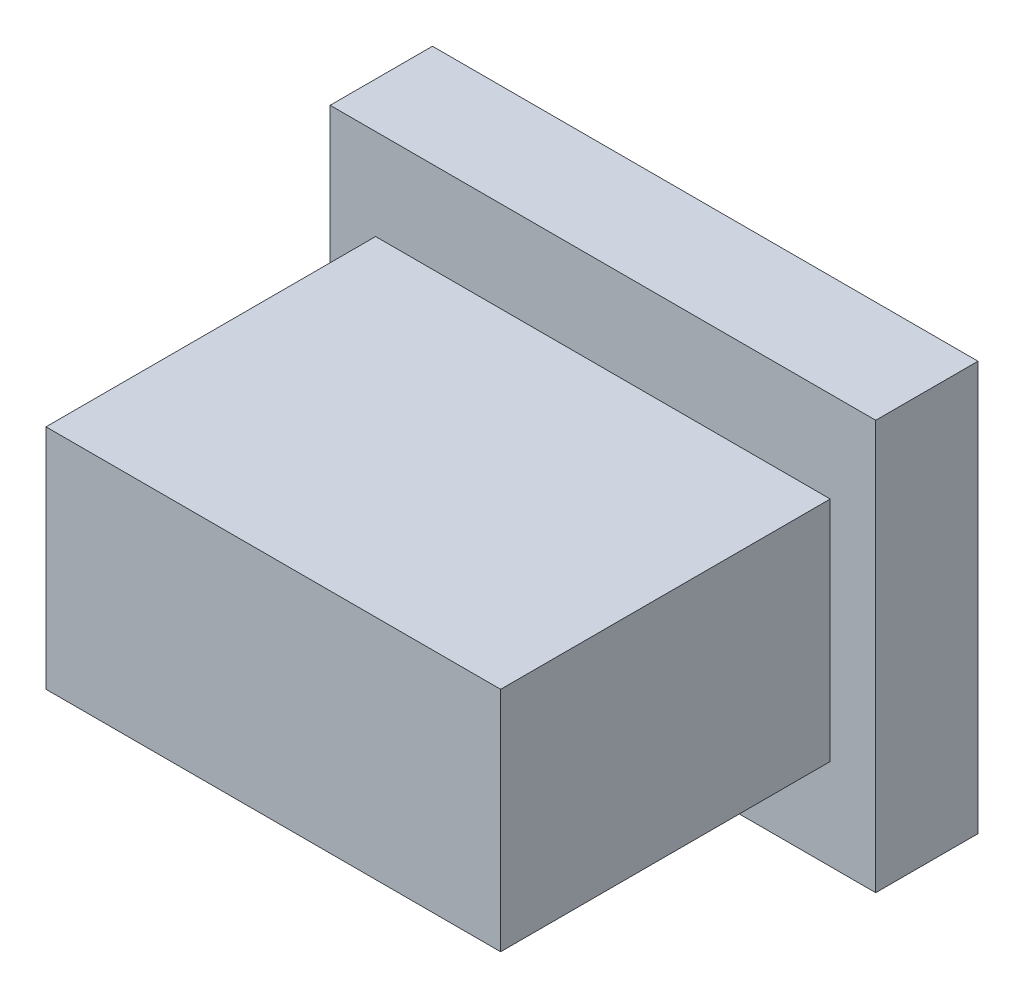
from build123d import *

# Parameters (mm, degrees)
SKETCH1_W           = 12
SKETCH1_H           = 9
SKETCH1_W_2         = 10
SKETCH1_H_2         = 5
BOSS_EXTRUDE1_DEPTH = 2.25
SKETCH1_3_W         = 10
SKETCH1_3_H         = 5
BOSS_EXTRUDE2_DEPTH = 9.5


with BuildPart() as part:
    # Sketch1 → Boss-Extrude1 (new body)
    with BuildSketch(Plane.XY):
        with Locations((5, 2.5)):
            Rectangle(SKETCH1_W, SKETCH1_H)
        with Locations((5, 2.5)):
            Rectangle(SKETCH1_W_2, SKETCH1_H_2, mode=Mode.SUBTRACT)
    extrude(amount=BOSS_EXTRUDE1_DEPTH)

    # Sketch1<3> → Boss-Extrude2 (add)
    with BuildSketch(Plane.XY):
        with Locations((5, 2.5)):
            Rectangle(SKETCH1_3_W, SKETCH1_3_H)
    extrude(amount=BOSS_EXTRUDE2_DEPTH)


solid = part.part
